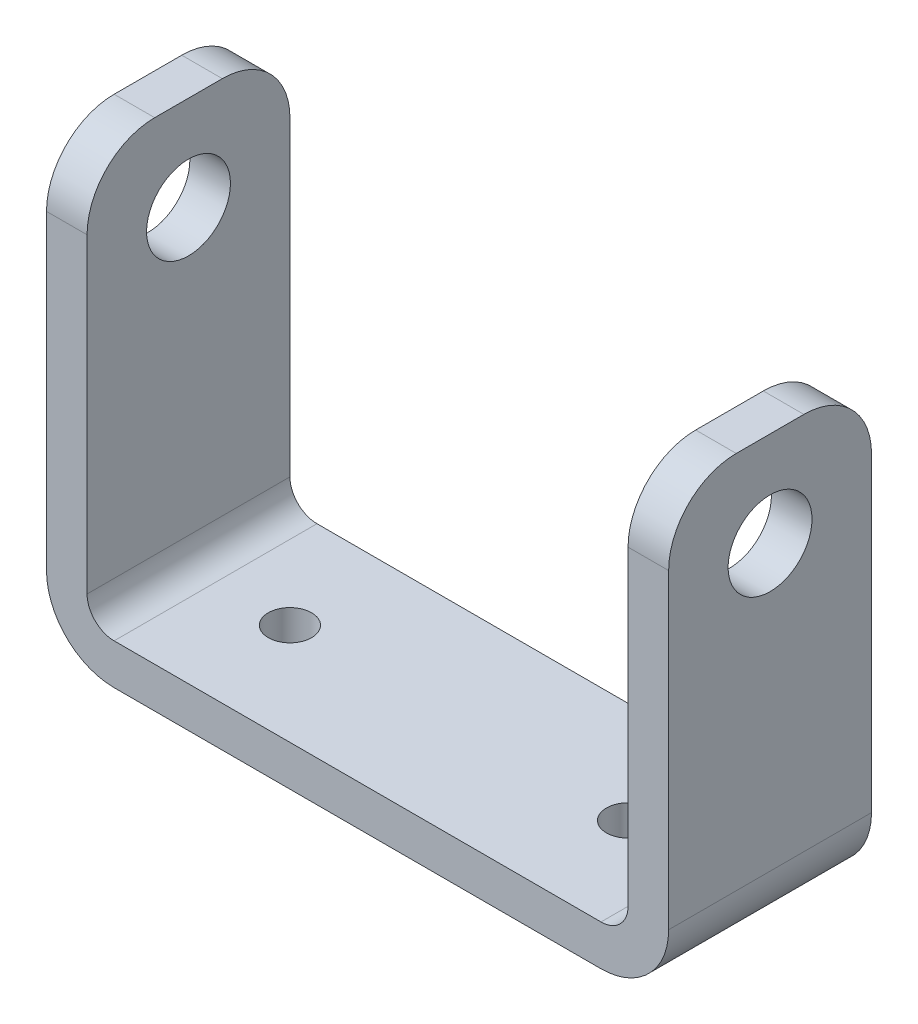
from build123d import *

# Parameters (mm, degrees)
EXTRUDE_1_DEPTH     = 15
SKETCH_2_R          = 3.1
CUT_EXTRUDE_1_DEPTH = 59.566201857
FILLET_1_R          = 5
SKETCH_3_R          = 1.6
CUT_EXTRUDE_2_DEPTH = 55.534392818
FILLET_3_R          = 2
FILLET_4_R          = 5


with BuildPart() as part:
    # ｽｹｯﾁ1 → ﾎﾞｽ - 押し出し1 (new body)
    with BuildSketch(Plane.XY):
        Polygon((0, 0), (0, -30), (40, -30), (40, 0), (43, 0), (43, -33), (-3, -33), (-3, 0), align=None)
    extrude(amount=EXTRUDE_1_DEPTH)

    # ｽｹｯﾁ2 → ｶｯﾄ - 押し出し1 (cut, through all)
    with BuildSketch(Plane(origin=(43, 0, 0), x_dir=(0, 0, -1), z_dir=(1, 0, 0))):
        with Locations((-7.5, -7)):
            Circle(SKETCH_2_R)
    extrude(amount=-CUT_EXTRUDE_1_DEPTH, mode=Mode.SUBTRACT)

    # ﾌｨﾚｯﾄ1
    fillet_1_edges = [part.edges().sort_by_distance(p)[0] for p in [
        (-1.5, 0, 0),
        (41.5, 0, 15),
        (-1.5, 0, 15),
        (41.5, 0, 0),
    ]]
    fillet(fillet_1_edges, radius=FILLET_1_R)

    # ｽｹｯﾁ3 → ｶｯﾄ - 押し出し2 (cut, through all)
    with BuildSketch(Plane(origin=(0, -30, 0), x_dir=(1, 0, 0), z_dir=(0, 1, 0))):
        with Locations(Location((7.5, -7.5, 0), (0, 0, 270))):
            Circle(SKETCH_3_R)
        with Locations(Location((32.5, -7.5, 0), (0, 0, 270))):
            Circle(SKETCH_3_R)
    extrude(amount=-CUT_EXTRUDE_2_DEPTH, mode=Mode.SUBTRACT)

    # ﾌｨﾚｯﾄ3
    fillet_3_edges = [part.edges().sort_by_distance(p)[0] for p in [
        (0, -30, 7.5),
        (40, -30, 7.5),
    ]]
    fillet(fillet_3_edges, radius=FILLET_3_R)

    # ﾌｨﾚｯﾄ4
    fillet_4_edges = [part.edges().sort_by_distance(p)[0] for p in [
        (43, -33, 7.5),
        (-3, -33, 7.5),
    ]]
    fillet(fillet_4_edges, radius=FILLET_4_R)


solid = part.part
